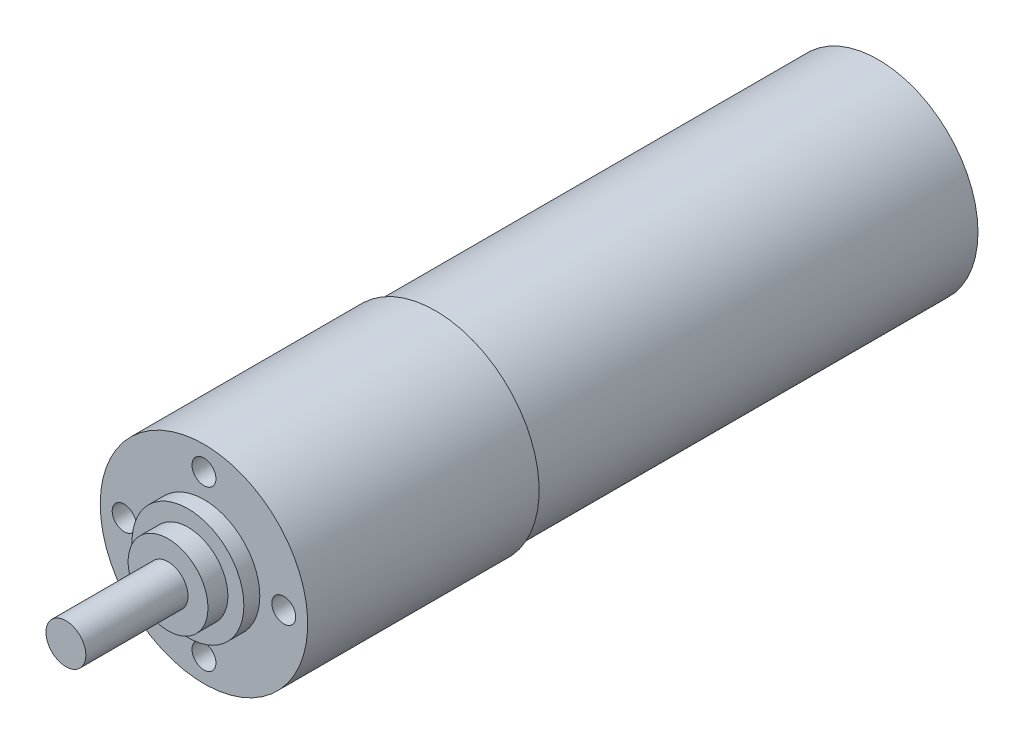
from build123d import *

# Parameters (mm, degrees)
SKETCH_1_R          = 12.5
EXTRUDE_1_DEPTH     = 55.5
SKETCH_2_R          = 13
EXTRUDE_1_2_DEPTH   = 29
SKETCH_3_R          = 7
EXTRUDE_2_DEPTH     = 2
SKETCH_4_R          = 5
EXTRUDE_3_DEPTH     = 2.5
SKETCH_5_R          = 2.5
EXTRUDE_4_DEPTH     = 12.8
SKETCH_6_R          = 1.5
CUT_EXTRUDE_1_DEPTH = 4


with BuildPart() as part:
    # 스케치1 → Extrude 1 (new body)
    with BuildSketch(Plane.XY):
        Circle(SKETCH_1_R)
    extrude(amount=EXTRUDE_1_DEPTH)

    # 스케치2 → Extrude 1 2 (add)
    with BuildSketch(Plane.XY.offset(55.5)):
        with Locations(Location((0, 0, 0), (0, 0, 180))):
            Circle(SKETCH_2_R)
    extrude(amount=EXTRUDE_1_2_DEPTH)

    # 스케치3 → 보스-돌출2 (add)
    with BuildSketch(Plane.XY.offset(84.5)):
        Circle(SKETCH_3_R)
    extrude(amount=EXTRUDE_2_DEPTH)

    # 스케치4 → 보스-돌출3 (add)
    with BuildSketch(Plane.XY.offset(86.5)):
        Circle(SKETCH_4_R)
    extrude(amount=EXTRUDE_3_DEPTH)

    # 스케치5 → 보스-돌출4 (add)
    with BuildSketch(Plane.XY.offset(89)):
        Circle(SKETCH_5_R)
    extrude(amount=EXTRUDE_4_DEPTH)

    # 스케치6 → 컷-돌출1 (cut)
    with BuildSketch(Plane.XY.offset(84.5)):
        with Locations((0, 10)):
            Circle(SKETCH_6_R)
        with Locations((10, 0)):
            Circle(SKETCH_6_R)
        with Locations((0, -10)):
            Circle(SKETCH_6_R)
        with Locations((-10, 0)):
            Circle(SKETCH_6_R)
    extrude(amount=-CUT_EXTRUDE_1_DEPTH, mode=Mode.SUBTRACT)


solid = part.part
